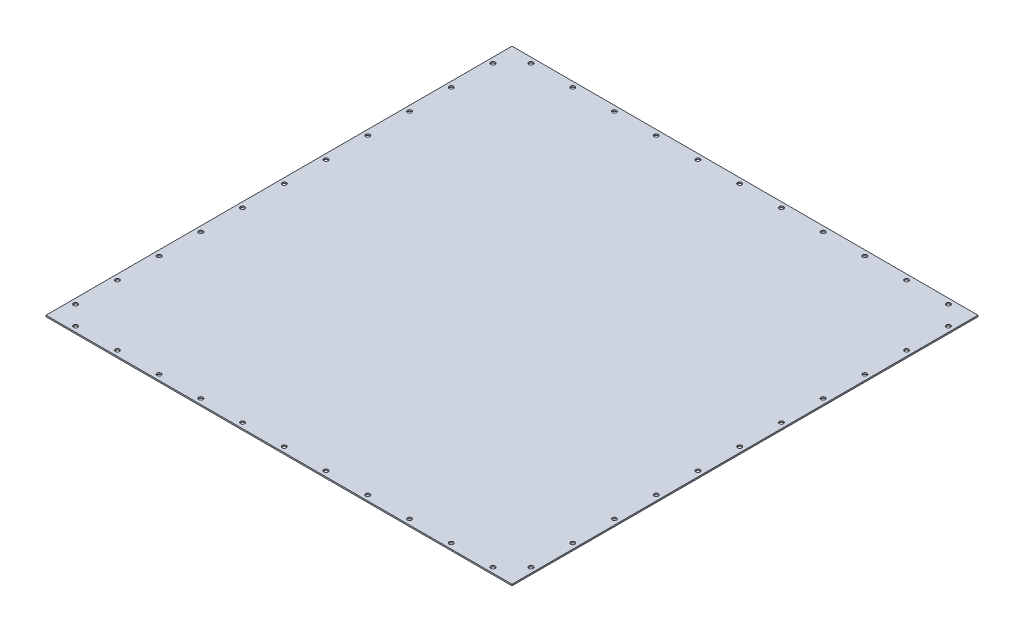
from build123d import *

# Parameters (mm, degrees)
SKETCH1_W           = 1317.5
SKETCH1_H           = 1317.5
SKETCH1_R           = 6
BOSS_EXTRUDE1_DEPTH = 2


with BuildPart() as part:
    # Sketch1 → Boss-Extrude1 (new, symmetric)
    with BuildSketch(Plane(origin=(0, 0, 0), x_dir=(1, 0, 0), z_dir=(0, 1, 0))):
        Rectangle(SKETCH1_W, SKETCH1_H)
        with Locations(Location((-590, -643.75, 0), (0, 0, 270))):
            Circle(SKETCH1_R, mode=Mode.SUBTRACT)
        with Locations(Location((-472, -643.75, 0), (0, 0, 270))):
            Circle(SKETCH1_R, mode=Mode.SUBTRACT)
        with Locations(Location((-354, -643.75, 0), (0, 0, 270))):
            Circle(SKETCH1_R, mode=Mode.SUBTRACT)
        with Locations(Location((-236, -643.75, 0), (0, 0, 270))):
            Circle(SKETCH1_R, mode=Mode.SUBTRACT)
        with Locations(Location((-118, -643.75, 0), (0, 0, 270))):
            Circle(SKETCH1_R, mode=Mode.SUBTRACT)
        with Locations(Location((0, -643.75, 0), (0, 0, 270))):
            Circle(SKETCH1_R, mode=Mode.SUBTRACT)
        with Locations(Location((118, -643.75, 0), (0, 0, 270))):
            Circle(SKETCH1_R, mode=Mode.SUBTRACT)
        with Locations(Location((236, -643.75, 0), (0, 0, 270))):
            Circle(SKETCH1_R, mode=Mode.SUBTRACT)
        with Locations(Location((354, -643.75, 0), (0, 0, 270))):
            Circle(SKETCH1_R, mode=Mode.SUBTRACT)
        with Locations(Location((472, -643.75, 0), (0, 0, 270))):
            Circle(SKETCH1_R, mode=Mode.SUBTRACT)
        with Locations(Location((590, -643.75, 0), (0, 0, 270))):
            Circle(SKETCH1_R, mode=Mode.SUBTRACT)
        with Locations(Location((590, 643.75, 0), (0, 0, 90))):
            Circle(SKETCH1_R, mode=Mode.SUBTRACT)
        with Locations(Location((472, 643.75, 0), (0, 0, 90))):
            Circle(SKETCH1_R, mode=Mode.SUBTRACT)
        with Locations(Location((354, 643.75, 0), (0, 0, 90))):
            Circle(SKETCH1_R, mode=Mode.SUBTRACT)
        with Locations(Location((236, 643.75, 0), (0, 0, 90))):
            Circle(SKETCH1_R, mode=Mode.SUBTRACT)
        with Locations(Location((118, 643.75, 0), (0, 0, 90))):
            Circle(SKETCH1_R, mode=Mode.SUBTRACT)
        with Locations(Location((0, 643.75, 0), (0, 0, 90))):
            Circle(SKETCH1_R, mode=Mode.SUBTRACT)
        with Locations(Location((-118, 643.75, 0), (0, 0, 90))):
            Circle(SKETCH1_R, mode=Mode.SUBTRACT)
        with Locations(Location((-236, 643.75, 0), (0, 0, 90))):
            Circle(SKETCH1_R, mode=Mode.SUBTRACT)
        with Locations(Location((-354, 643.75, 0), (0, 0, 90))):
            Circle(SKETCH1_R, mode=Mode.SUBTRACT)
        with Locations(Location((-472, 643.75, 0), (0, 0, 90))):
            Circle(SKETCH1_R, mode=Mode.SUBTRACT)
        with Locations(Location((-590, 643.75, 0), (0, 0, 90))):
            Circle(SKETCH1_R, mode=Mode.SUBTRACT)
        with Locations(Location((643.75, 590, 0), (0, 0, 270))):
            Circle(SKETCH1_R, mode=Mode.SUBTRACT)
        with Locations(Location((643.75, 472, 0), (0, 0, 270))):
            Circle(SKETCH1_R, mode=Mode.SUBTRACT)
        with Locations(Location((643.75, 354, 0), (0, 0, 270))):
            Circle(SKETCH1_R, mode=Mode.SUBTRACT)
        with Locations(Location((643.75, 236, 0), (0, 0, 270))):
            Circle(SKETCH1_R, mode=Mode.SUBTRACT)
        with Locations(Location((643.75, 118, 0), (0, 0, 270))):
            Circle(SKETCH1_R, mode=Mode.SUBTRACT)
        with Locations(Location((643.75, 0, 0), (0, 0, 270))):
            Circle(SKETCH1_R, mode=Mode.SUBTRACT)
        with Locations(Location((643.75, -118, 0), (0, 0, 270))):
            Circle(SKETCH1_R, mode=Mode.SUBTRACT)
        with Locations(Location((643.75, -236, 0), (0, 0, 270))):
            Circle(SKETCH1_R, mode=Mode.SUBTRACT)
        with Locations(Location((643.75, -354, 0), (0, 0, 270))):
            Circle(SKETCH1_R, mode=Mode.SUBTRACT)
        with Locations(Location((643.75, -472, 0), (0, 0, 270))):
            Circle(SKETCH1_R, mode=Mode.SUBTRACT)
        with Locations(Location((643.75, -590, 0), (0, 0, 270))):
            Circle(SKETCH1_R, mode=Mode.SUBTRACT)
        with Locations(Location((-643.75, -590, 0), (0, 0, 90))):
            Circle(SKETCH1_R, mode=Mode.SUBTRACT)
        with Locations(Location((-643.75, -472, 0), (0, 0, 90))):
            Circle(SKETCH1_R, mode=Mode.SUBTRACT)
        with Locations(Location((-643.75, -354, 0), (0, 0, 90))):
            Circle(SKETCH1_R, mode=Mode.SUBTRACT)
        with Locations(Location((-643.75, -236, 0), (0, 0, 90))):
            Circle(SKETCH1_R, mode=Mode.SUBTRACT)
        with Locations(Location((-643.75, -118, 0), (0, 0, 90))):
            Circle(SKETCH1_R, mode=Mode.SUBTRACT)
        with Locations(Location((-643.75, 0, 0), (0, 0, 90))):
            Circle(SKETCH1_R, mode=Mode.SUBTRACT)
        with Locations(Location((-643.75, 118, 0), (0, 0, 90))):
            Circle(SKETCH1_R, mode=Mode.SUBTRACT)
        with Locations(Location((-643.75, 236, 0), (0, 0, 90))):
            Circle(SKETCH1_R, mode=Mode.SUBTRACT)
        with Locations(Location((-643.75, 354, 0), (0, 0, 90))):
            Circle(SKETCH1_R, mode=Mode.SUBTRACT)
        with Locations(Location((-643.75, 472, 0), (0, 0, 90))):
            Circle(SKETCH1_R, mode=Mode.SUBTRACT)
        with Locations(Location((-643.75, 590, 0), (0, 0, 90))):
            Circle(SKETCH1_R, mode=Mode.SUBTRACT)
    extrude(amount=BOSS_EXTRUDE1_DEPTH, both=True)


solid = part.part
